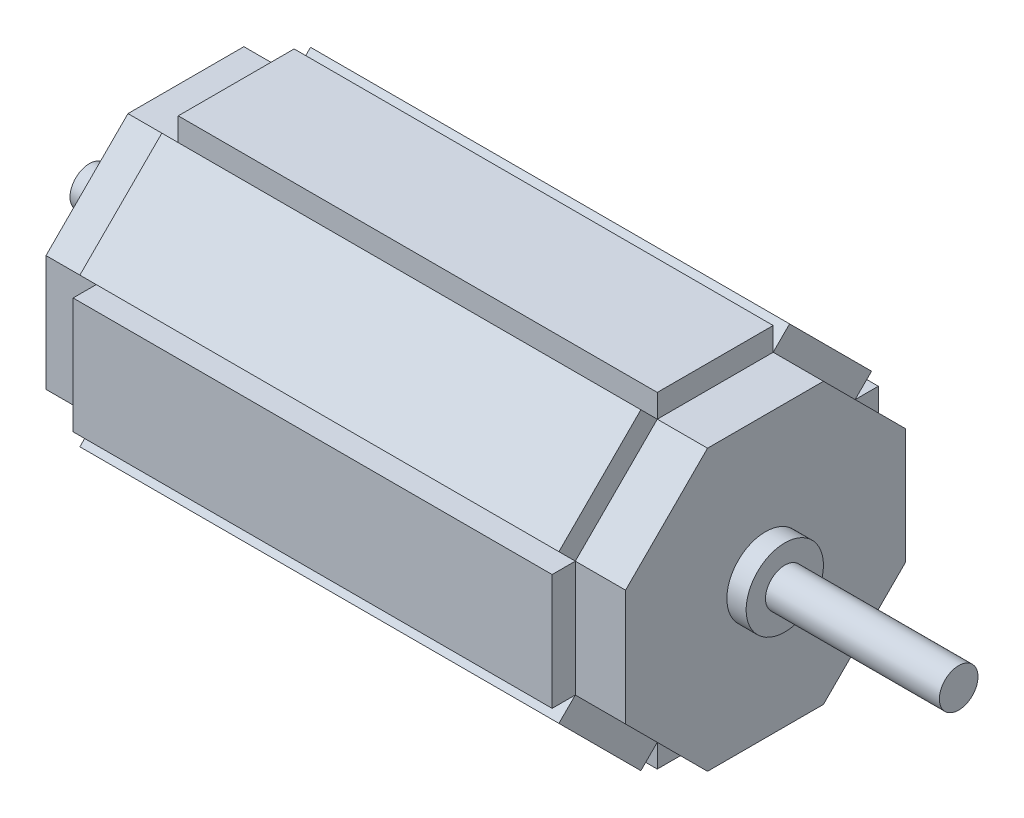
from build123d import *

# Parameters (mm, degrees)
EXTRUDE_1_DEPTH          = 30
SKETCH_4_R               = 1
EXTRUDE_2_DEPTH          = 10
SKETCH_5_R               = 2
EXTRUDE_3_DEPTH          = 1
EXTRUDE_START            = 5
SKETCH_6_R               = 1
EXTRUDE_4_DEPTH          = 5
EXTRUDE_START_2          = 1
SKETCH_7_R               = 2
EXTRUDE_5_DEPTH          = 1
SKETCH_8_W               = 24.796417242
SKETCH_8_H               = 6
EXTRUDE_6_DEPTH          = 1.2
PATTERN_CIRCULAR_1_COUNT = 8


with BuildPart() as part:
    # 草图1 → 凸台-拉伸1 (new body)
    with BuildSketch(Plane(origin=(0, 0, 0), x_dir=(0, 0, -1), z_dir=(1, 0, 0))):
        Polygon((7.242640687, -3), (7.242640687, 3), (3, 7.242640687), (-3, 7.242640687), (-7.242640687, 3), (-7.242640687, -3), (-3, -7.242640687), (3, -7.242640687), align=None)
    extrude(amount=EXTRUDE_1_DEPTH)

    # 草图4 → 凸台-拉伸2 (add)
    with BuildSketch(Plane(origin=(30, 0, 0), x_dir=(0, 0, -1), z_dir=(1, 0, 0))):
        Circle(SKETCH_4_R)
    extrude(amount=EXTRUDE_2_DEPTH)

    # 草图5 → 凸台-拉伸3 (add)
    with BuildSketch(Plane(origin=(30, 0, 0), x_dir=(0, 0, -1), z_dir=(1, 0, 0))):
        Circle(SKETCH_5_R)
    extrude(amount=EXTRUDE_3_DEPTH)

    # 草图6 → 凸台-拉伸4 (add)
    with BuildSketch(Plane.ZY.offset(EXTRUDE_START)):
        with Locations(Location((0, 0, 0), (0, 0, 180))):
            Circle(SKETCH_6_R)
    extrude(amount=-EXTRUDE_4_DEPTH)

    # 草图7 → 凸台-拉伸5 (add)
    with BuildSketch(Plane.ZY.offset(EXTRUDE_START_2)):
        with Locations(Location((0, 0, 0), (0, 0, 180))):
            Circle(SKETCH_7_R)
    extrude(amount=-EXTRUDE_5_DEPTH)

    # 草图8 → 凸台-拉伸6 (add)
    with BuildSketch(Plane(origin=(0, 7.242640687, 0), x_dir=(1, 0, 0), z_dir=(0, 1, 0))):
        with Locations((15, 0)):
            Rectangle(SKETCH_8_W, SKETCH_8_H)
    extrude_6 = extrude(amount=EXTRUDE_6_DEPTH)

    # 阵列(圆周)1: 凸台-拉伸6 ×8 about axis
    pattern_circular_1_axis = Axis((0, 0, 0), (1, 0, 0))
    for i in range(1, PATTERN_CIRCULAR_1_COUNT):
        add(extrude_6.rotate(pattern_circular_1_axis, i * 360 / PATTERN_CIRCULAR_1_COUNT))


solid = part.part
